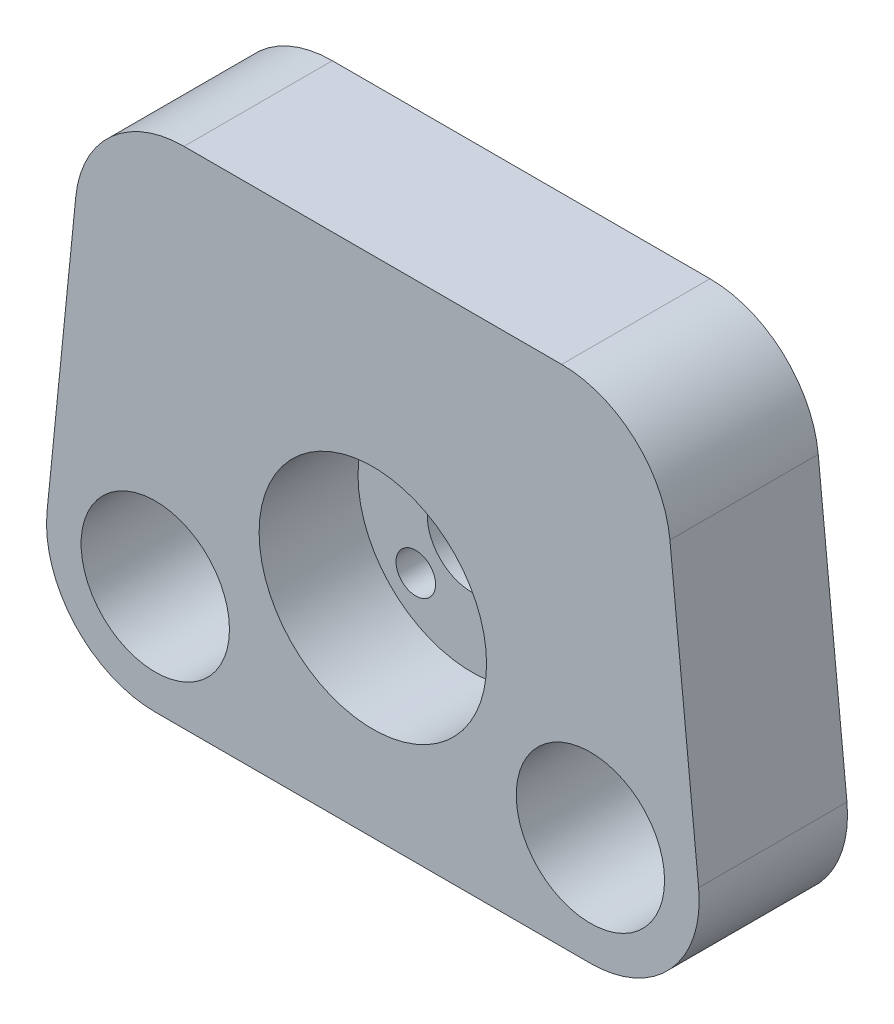
from build123d import *

# Parameters (mm, degrees)
CROQUIS2_R                   = 7.5
CROQUIS2_R_2                 = 4.5
SALIENTE_EXTRUIR1_DEPTH      = 15
REDONDEO2_R                  = 11
CROQUIS4_R                   = 11.5
CORTAR_EXTRUIR1_DEPTH        = 10
TALADRO_DE_MARGEN_PARA_M31_D = 4
MATRIZC1_COUNT               = 4


with BuildPart() as part:
    # Croquis2 → Saliente-Extruir1 (new body)
    with BuildSketch(Plane.XY):
        Polygon((-34.156880773, -21), (34.156880773, -21), (29.048373678, 30), (-29.048373678, 30), align=None)
        with Locations((22, -10)):
            Circle(CROQUIS2_R, mode=Mode.SUBTRACT)
        with Locations((-22, -10)):
            Circle(CROQUIS2_R, mode=Mode.SUBTRACT)
        Circle(CROQUIS2_R_2, mode=Mode.SUBTRACT)
    extrude(amount=SALIENTE_EXTRUIR1_DEPTH)

    # Redondeo2
    redondeo2_edges = [part.edges().sort_by_distance(p)[0] for p in [
        (34.156880773, -21, 7.5),
        (-34.156880773, -21, 7.5),
        (-29.048373678, 30, 7.5),
        (29.048373678, 30, 7.5),
    ]]
    fillet(redondeo2_edges, radius=REDONDEO2_R)

    # Croquis4 → Cortar-Extruir1 (cut)
    with BuildSketch(Plane.XY.offset(15)):
        Circle(CROQUIS4_R)
    extrude(amount=-CORTAR_EXTRUIR1_DEPTH, mode=Mode.SUBTRACT)

    # Taladro de margen para M31 (through all)
    with Locations(Plane(origin=(0, 0, 0), x_dir=(-1, 0, 0), z_dir=(0, 0, -1))):
        with Locations((-5.656854249, 5.656854249)):
            taladro_de_margen_para_m31 = Hole(TALADRO_DE_MARGEN_PARA_M31_D / 2)

    # MatrizC1: Taladro de margen para M31 ×4 about axis
    matrizc1_axis = Axis((0, 0, 0), (0, 0, 1))
    for i in range(1, MATRIZC1_COUNT):
        add(taladro_de_margen_para_m31.rotate(matrizc1_axis, i * 360 / MATRIZC1_COUNT), mode=Mode.SUBTRACT)


solid = part.part
